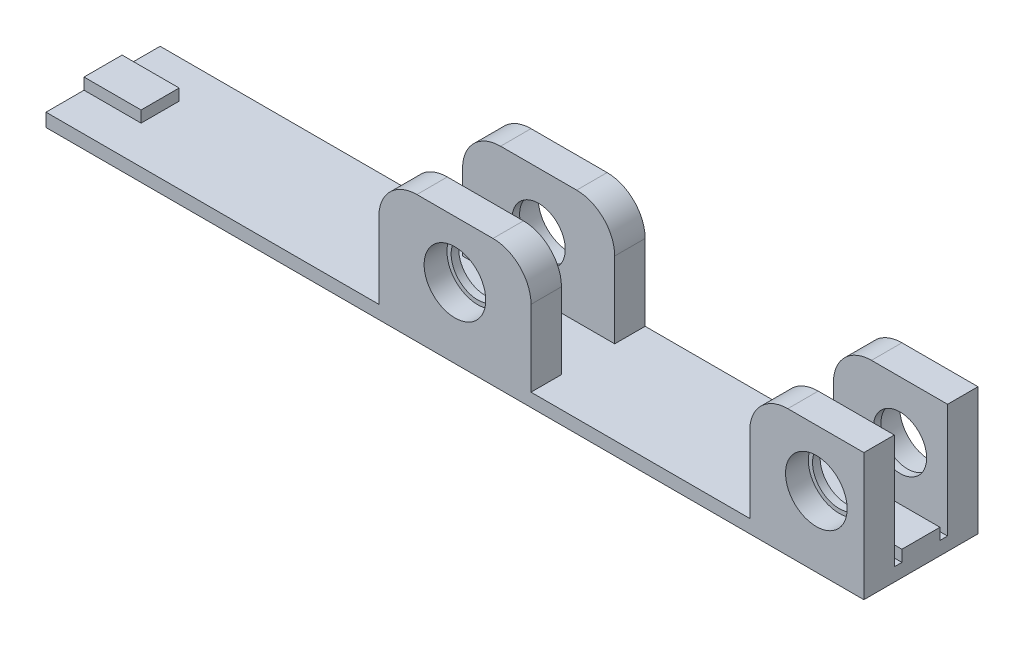
from build123d import *

# Parameters (mm, degrees)
SKETCH2_W           = 215
SKETCH2_H           = 30
BOSS_EXTRUDE1_DEPTH = 3.5
SKETCH4_W           = 30
SKETCH4_H           = 8
SKETCH4_W_2         = 40
BOSS_EXTRUDE2_DEPTH = 30
SKETCH5_R           = 8.1
BEARING_HOLES_DEPTH = 6
SKETCH7_R           = 7
CUT_EXTRUDE2_DEPTH  = 116.128189424
FILLET1_R           = 10
HOLES_TBD_R         = 1.65
CUT_EXTRUDE1_DEPTH  = 113.611056296
SKETCH6_W           = 15
SKETCH6_H           = 10
BOSS_EXTRUDE3_DEPTH = 3


with BuildPart() as part:
    # Sketch2 → Boss-Extrude1 (new body)
    with BuildSketch(Plane(origin=(0, 0, 0), x_dir=(1, 0, 0), z_dir=(0, 1, 0))):
        Rectangle(SKETCH2_W, SKETCH2_H)
    extrude(amount=BOSS_EXTRUDE1_DEPTH)

    # Sketch4 → Boss-Extrude2 (add)
    with BuildSketch(Plane(origin=(0, 3.5, 0), x_dir=(1, 0, 0), z_dir=(0, 1, 0))):
        with Locations((92.5, -11)):
            Rectangle(SKETCH4_W, SKETCH4_H)
        with Locations((0, -11)):
            Rectangle(SKETCH4_W_2, SKETCH4_H)
        with Locations((0, 11)):
            Rectangle(SKETCH4_W_2, SKETCH4_H)
        with Locations((92.5, 11)):
            Rectangle(SKETCH4_W, SKETCH4_H)
    extrude(amount=BOSS_EXTRUDE2_DEPTH)

    # Sketch5 → Bearing holes (cut)
    with BuildSketch(Plane.XY.offset(15)):
        with Locations((0, 18.5)):
            Circle(SKETCH5_R)
        with Locations((95, 18.5)):
            Circle(SKETCH5_R)
    bearing_holes = extrude(amount=-BEARING_HOLES_DEPTH, mode=Mode.SUBTRACT)

    # Mirror1: Bearing holes across plane
    add(bearing_holes.mirror(Plane.XY), mode=Mode.SUBTRACT)

    # Sketch7 → Cut-Extrude2 (cut, through all)
    with BuildSketch(Plane.XY.offset(9)):
        with Locations(Location((0, 18.5, 0), (0, 0, 180))):
            Circle(SKETCH7_R)
        with Locations(Location((95, 18.5, 0), (0, 0, 180))):
            Circle(SKETCH7_R)
    extrude(amount=-CUT_EXTRUDE2_DEPTH, mode=Mode.SUBTRACT)

    # Fillet1
    fillet1_edges = [part.edges().sort_by_distance(p)[0] for p in [
        (77.5, 33.5, -11),
        (-20, 33.5, -11),
        (20, 33.5, -11),
        (-20, 33.5, 11),
        (20, 33.5, 11),
        (77.5, 33.5, 11),
    ]]
    fillet(fillet1_edges, radius=FILLET1_R)

    # HOLES TBD → Cut-Extrude1 (cut, through all)
    with BuildSketch(Plane(origin=(0, 3.5, 0), x_dir=(1, 0, 0), z_dir=(0, 1, 0))):
        with Locations(Location((-100, 0, 0), (0, 0, 270))):
            Circle(HOLES_TBD_R)
        with Locations(Location((100, 0, 0), (0, 0, 270))):
            Circle(HOLES_TBD_R)
    extrude(amount=-CUT_EXTRUDE1_DEPTH, mode=Mode.SUBTRACT)

    # Sketch6 → Boss-Extrude3 (add)
    with BuildSketch(Plane(origin=(0, 3.5, 0), x_dir=(1, 0, 0), z_dir=(0, 1, 0))):
        with Locations((-100, 0)):
            Rectangle(SKETCH6_W, SKETCH6_H)
        with Locations((100, 0)):
            Rectangle(SKETCH6_W, SKETCH6_H)
    extrude(amount=BOSS_EXTRUDE3_DEPTH)


solid = part.part
